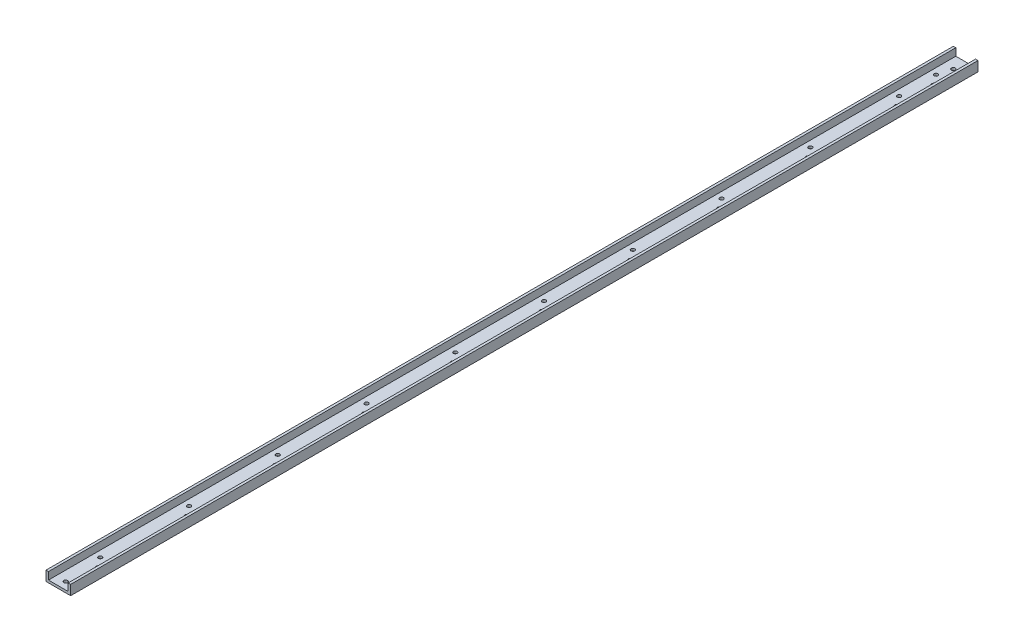
from build123d import *

# Parameters (mm, degrees)
BOSS_EXTRUDE1_DEPTH = 1168.4
CUT_EXTRUDE1_REACH  = 1170.87
SKETCH3_R           = 2.413
CUT_EXTRUDE2_REACH  = 1170.87
SKETCH4_R           = 2.413
LPATTERN1_COUNT     = 10
LPATTERN1_PITCH     = 114.3
CUT_EXTRUDE3_REACH  = 1170.9
SKETCH5_R           = 2.413
CUT_EXTRUDE4_REACH  = 1170.87
SKETCH6_R           = 2.413


with BuildPart() as part:
    # Sketch1 → Boss-Extrude1 (new body)
    with BuildSketch(Plane.XY):
        Polygon((3.175, 3.175), (3.175, 12.7), (0, 12.7), (0, 0), (31.75, 0), (31.75, 12.7), (28.575, 12.7), (28.575, 3.175), align=None)
    extrude(amount=BOSS_EXTRUDE1_DEPTH)

    # Sketch3 → Cut-Extrude1 (cut, up to next)
    with BuildSketch(Plane(origin=(0, 3.175, 0), x_dir=(1, 0, 0), z_dir=(0, 1, 0)), mode=Mode.PRIVATE) as cut_extrude1_sk1:
        with Locations(Location((11.1125, -1109.6625, 0), (0, 0, 270))):
            Circle(SKETCH3_R)
    cut_extrude1_tool1 = extrude(cut_extrude1_sk1.sketch, amount=-CUT_EXTRUDE1_REACH, mode=Mode.PRIVATE) & part.part
    # Sketch3 → Cut-Extrude1 (cut, up to next)
    with BuildSketch(Plane(origin=(0, 3.175, 0), x_dir=(1, 0, 0), z_dir=(0, 1, 0)), mode=Mode.PRIVATE) as cut_extrude1_sk2:
        with Locations(Location((20.6375, -1122.3625, 0), (0, 0, 270))):
            Circle(SKETCH3_R)
    cut_extrude1_tool2 = extrude(cut_extrude1_sk2.sketch, amount=-CUT_EXTRUDE1_REACH, mode=Mode.PRIVATE) & part.part
    cut_extrude1_1 = cut_extrude1_tool1.solids().sort_by_distance((11.1125, 3.175, 1109.6625))[0]
    add(cut_extrude1_1, mode=Mode.SUBTRACT)
    cut_extrude1_2 = cut_extrude1_tool2.solids().sort_by_distance((20.6375, 3.175, 1122.3625))[0]
    add(cut_extrude1_2, mode=Mode.SUBTRACT)
    cut_extrude1 = cut_extrude1_1 + cut_extrude1_2  # Cut-Extrude1 as one shape, for the pattern or mirror that repeats it

    # Sketch4 → Cut-Extrude2 (cut, up to next)
    with BuildSketch(Plane(origin=(0, 3.175, 0), x_dir=(1, 0, 0), z_dir=(0, 1, 0)), mode=Mode.PRIVATE) as cut_extrude2_sk1:
        with Locations(Location((15.875, -1158.875, 0), (0, 0, 270))):
            Circle(SKETCH4_R)
    cut_extrude2_tool1 = extrude(cut_extrude2_sk1.sketch, amount=-CUT_EXTRUDE2_REACH, mode=Mode.PRIVATE) & part.part
    add(cut_extrude2_tool1.solids().sort_by_distance((15.875, 3.175, 1158.875))[0], mode=Mode.SUBTRACT)

    # LPattern1: Cut-Extrude1 ×10
    with Locations(*[(0, 0, -i * LPATTERN1_PITCH) for i in range(1, LPATTERN1_COUNT)]):
        add(cut_extrude1, mode=Mode.SUBTRACT)

    # Sketch5 → Cut-Extrude3 (cut, up to next)
    with BuildSketch(Plane.XZ, mode=Mode.PRIVATE) as cut_extrude3_sk1:
        with Locations(Location((11.1125, 33.3375, 0), (0, 0, 270))):
            Circle(SKETCH5_R)
    cut_extrude3_tool1 = extrude(cut_extrude3_sk1.sketch, amount=-CUT_EXTRUDE3_REACH, mode=Mode.PRIVATE) & part.part
    # Sketch5 → Cut-Extrude3 (cut, up to next)
    with BuildSketch(Plane.XZ, mode=Mode.PRIVATE) as cut_extrude3_sk2:
        with Locations(Location((20.6375, 46.0375, 0), (0, 0, 270))):
            Circle(SKETCH5_R)
    cut_extrude3_tool2 = extrude(cut_extrude3_sk2.sketch, amount=-CUT_EXTRUDE3_REACH, mode=Mode.PRIVATE) & part.part
    add(cut_extrude3_tool1.solids().sort_by_distance((11.1125, 0, 33.3375))[0], mode=Mode.SUBTRACT)
    add(cut_extrude3_tool2.solids().sort_by_distance((20.6375, 0, 46.0375))[0], mode=Mode.SUBTRACT)

    # Sketch6 → Cut-Extrude4 (cut, up to next)
    with BuildSketch(Plane(origin=(0, 3.175, 0), x_dir=(1, 0, 0), z_dir=(0, 1, 0)), mode=Mode.PRIVATE) as cut_extrude4_sk1:
        with Locations(Location((15.875, -15.875, 0), (0, 0, 270))):
            Circle(SKETCH6_R)
    cut_extrude4_tool1 = extrude(cut_extrude4_sk1.sketch, amount=-CUT_EXTRUDE4_REACH, mode=Mode.PRIVATE) & part.part
    add(cut_extrude4_tool1.solids().sort_by_distance((15.875, 3.175, 15.875))[0], mode=Mode.SUBTRACT)


solid = part.part
